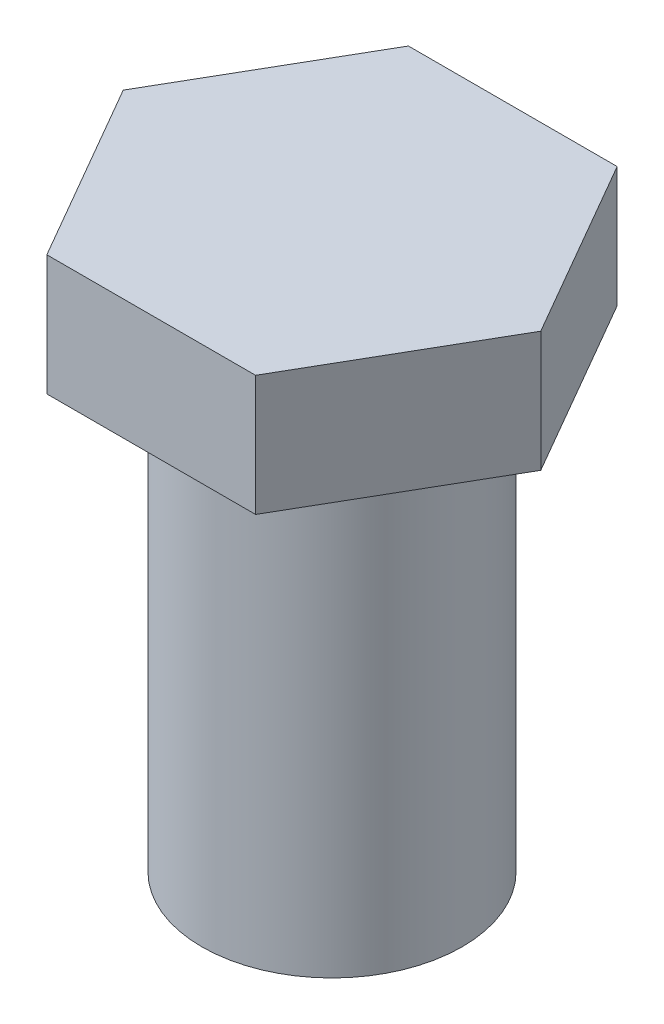
from build123d import *

# Parameters (mm, degrees)
SKETCH1_R           = 2.7432
BOSS_EXTRUDE1_DEPTH = 9.525
BOSS_EXTRUDE2_DEPTH = 2.54


with BuildPart() as part:
    # Sketch1 → Boss-Extrude1 (new body)
    with BuildSketch(Plane(origin=(0, 0, 0), x_dir=(1, 0, 0), z_dir=(0, 1, 0))):
        with Locations(Location((0, 0, 0), (0, 0, 270))):
            Circle(SKETCH1_R)
    extrude(amount=-BOSS_EXTRUDE1_DEPTH)

    # Sketch2 → Boss-Extrude2 (add)
    with BuildSketch(Plane(origin=(0, 0, 0), x_dir=(1, 0, 0), z_dir=(0, 1, 0))):
        Polygon((4.399409051, 0), (2.199704526, 3.81), (-2.199704526, 3.81), (-4.399409051, 0), (-2.199704526, -3.81), (2.199704526, -3.81), align=None)
    extrude(amount=BOSS_EXTRUDE2_DEPTH)


solid = part.part
